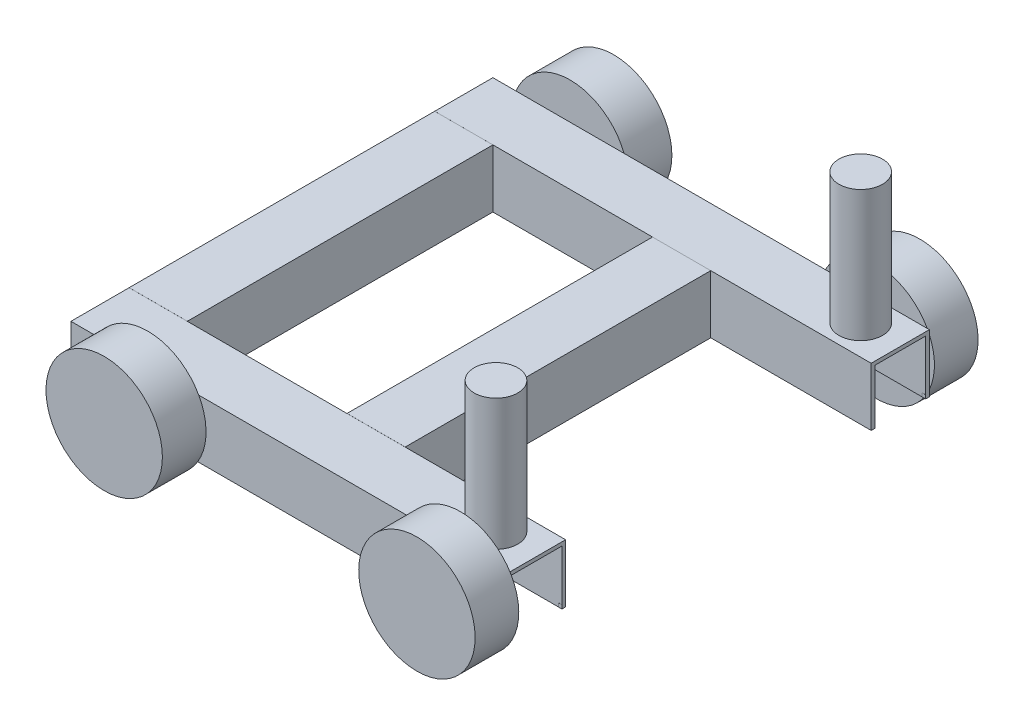
from build123d import *

# Parameters (mm, degrees)
SKETCH1_W             = 50.8
SKETCH1_H             = 266.7
BOSS_EXTRUDE1_DEPTH   = 50.8
SKETCH1_W_2           = 381
SKETCH1_H_2           = 50.8
BOSS_EXTRUDE1_2_DEPTH = 50.8
BOSS_EXTRUDE1_3_DEPTH = 50.8
BOSS_EXTRUDE1_4_DEPTH = 50.8
SHELL1_T              = -3.175
SHELL2_T              = -3.175
SHELL3_T              = -3.175
SHELL4_T              = -3.175
CUT_EXTRUDE2_DEPTH    = 448.056
CUT_EXTRUDE3_DEPTH    = 448.056
SKETCH4_R             = 19.05
BOSS_EXTRUDE2_DEPTH   = 114.3
SKETCH5_R             = 50.8
BOSS_EXTRUDE3_DEPTH   = 38.1
SKETCH6_R             = 50.8
BOSS_EXTRUDE5_DEPTH   = 38.1


with BuildPart() as part:
    # Sketch1 → Boss-Extrude1 (new body)
    with BuildSketch(Plane(origin=(0, 0, 0), x_dir=(1, 0, 0), z_dir=(0, 1, 0))):
        with Locations((-142.180377161, -83.893954499)):
            Rectangle(SKETCH1_W, SKETCH1_H)
    extrude(amount=BOSS_EXTRUDE1_DEPTH)

    # Shell3
    shell3_openings = [part.faces().sort_by_distance(p)[0] for p in [
        (-142.180377161, 0, 83.893954499),
    ]]
    offset(amount=SHELL3_T, openings=shell3_openings, kind=Kind.INTERSECTION)


with BuildPart() as body_2:
    # Sketch1 → Boss-Extrude1 2 (new body)
    with BuildSketch(Plane(origin=(0, 0, 0), x_dir=(1, 0, 0), z_dir=(0, 1, 0))):
        with Locations((22.945685454, -242.688539791)):
            Rectangle(SKETCH1_W_2, SKETCH1_H_2)
    extrude(amount=BOSS_EXTRUDE1_2_DEPTH)

    # Shell1
    shell1_openings = [body_2.faces().sort_by_distance(p)[0] for p in [
        (22.945685454, 0, 242.688539791),
    ]]
    offset(amount=SHELL1_T, openings=shell1_openings, kind=Kind.INTERSECTION)

    # Sketch2 → Cut-Extrude2 (cut)
    with BuildSketch(Plane(origin=(213.445685454, 0, 0), x_dir=(0, 0, -1), z_dir=(1, 0, 0))):
        Polygon((-264.913539791, 3.175), (-264.913539791, 0), (-220.49774804, 0), (-220.49774804, 3.175), (-220.463539791, 3.175), (-220.463539791, 47.625), (-264.913539791, 47.625), align=None)
    extrude(amount=-CUT_EXTRUDE2_DEPTH, mode=Mode.SUBTRACT)



with BuildPart() as body_3:
    # Sketch1 → Boss-Extrude1 3 (new body)
    with BuildSketch(Plane(origin=(0, 0, 0), x_dir=(1, 0, 0), z_dir=(0, 1, 0))):
        with Locations((22.918502853, 74.867899704)):
            Rectangle(SKETCH1_W_2, SKETCH1_H_2)
    extrude(amount=BOSS_EXTRUDE1_3_DEPTH)

    # Shell4
    shell4_openings = [body_3.faces().sort_by_distance(p)[0] for p in [
        (22.918502853, 0, -74.867899704),
    ]]
    offset(amount=SHELL4_T, openings=shell4_openings, kind=Kind.INTERSECTION)

    # Sketch3 → Cut-Extrude3 (cut)
    with BuildSketch(Plane(origin=(213.418502853, 0, 0), x_dir=(0, 0, -1), z_dir=(1, 0, 0))):
        Polygon((52.642899704, 3.175), (52.642899704, 0), (97.06541915, 0), (97.037938595, 3.175), (97.092899704, 3.175), (97.092899704, 47.625), (52.642899704, 47.625), align=None)
    extrude(amount=-CUT_EXTRUDE3_DEPTH, mode=Mode.SUBTRACT)


with BuildPart() as body_4:
    # Sketch1 → Boss-Extrude1 4 (new body)
    with BuildSketch(Plane(origin=(0, 0, 0), x_dir=(1, 0, 0), z_dir=(0, 1, 0))):
        with Locations((47.970482345, -83.882493933)):
            Rectangle(SKETCH1_W, SKETCH1_H)
    extrude(amount=BOSS_EXTRUDE1_4_DEPTH)

    # Shell2
    shell2_openings = [body_4.faces().sort_by_distance(p)[0] for p in [
        (47.970482345, 0, 83.882493933),
    ]]
    offset(amount=SHELL2_T, openings=shell2_openings, kind=Kind.INTERSECTION)


with BuildPart() as body_2_1:
    add(body_2.part)

    add(body_3.part)  # Boss-Extrude2 merges body 3
    # Sketch4 → Boss-Extrude2 (add)
    with BuildSketch(Plane(origin=(0, 50.8, 0), x_dir=(1, 0, 0), z_dir=(0, 1, 0))):
        with Locations(Location((176.89745747, -241.514307843, 0), (0, 0, 270))):
            Circle(SKETCH4_R)
        with Locations(Location((178.336360526, 75.424713992, 0), (0, 0, 270))):
            Circle(SKETCH4_R)
    extrude(amount=BOSS_EXTRUDE2_DEPTH)

    # Sketch5 → Boss-Extrude3 (add)
    with BuildSketch(Plane.XY.offset(268.088539791)):
        with Locations(Location((172.565739008, 26.157020355, 0), (0, 0, 150.981105093))):
            Circle(SKETCH5_R)
        with Locations(Location((-100.427548821, 26.157020355, 0), (0, 0, 150.981105093))):
            Circle(SKETCH5_R)
    extrude(amount=BOSS_EXTRUDE3_DEPTH)

    # Sketch6 → Boss-Extrude5 (add)
    with BuildSketch(Plane(origin=(0, 0, -100.267899704), x_dir=(-1, 0, 0), z_dir=(0, 0, -1))):
        with Locations(Location((-167.043243637, 26.262501017, 0), (0, 0, 155.909069776))):
            Circle(SKETCH6_R)
        with Locations(Location((100.229205576, 31.97555496, 0), (0, 0, 158.249845522))):
            Circle(SKETCH6_R)
    extrude(amount=BOSS_EXTRUDE5_DEPTH)


solid = Compound([part.part, body_4.part, body_2_1.part])
